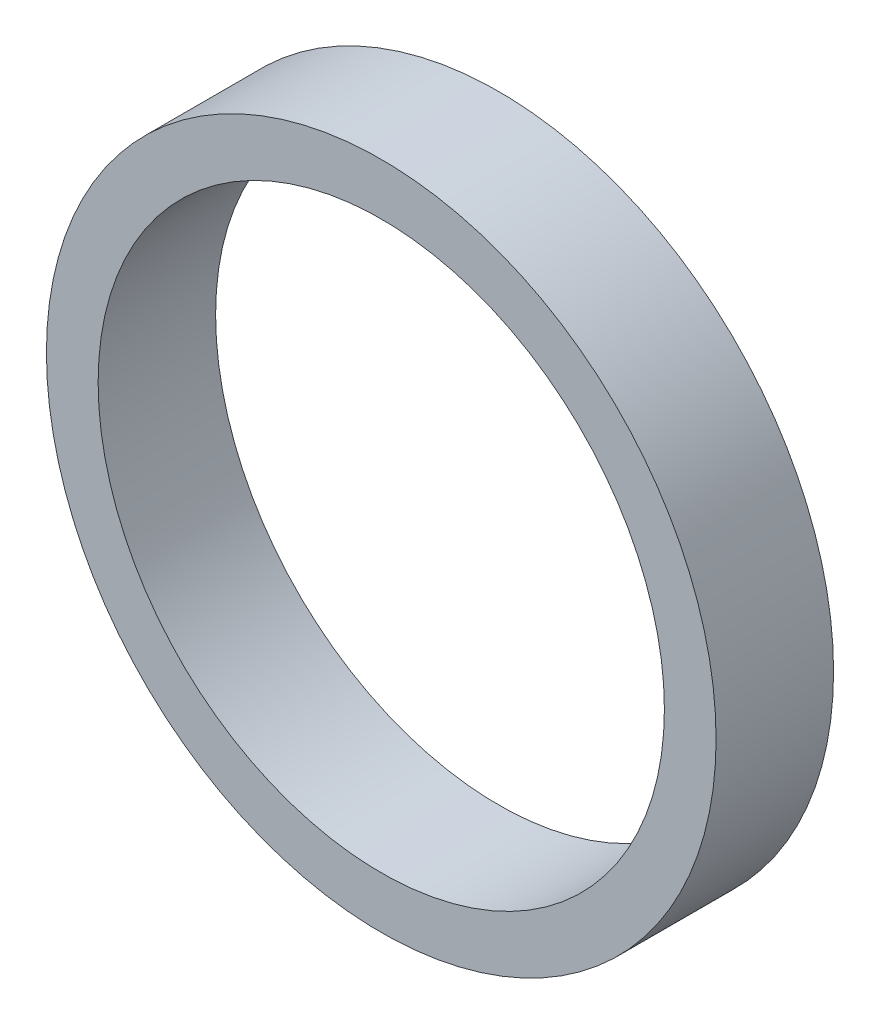
from build123d import *

# Parameters (mm, degrees)
SKETCH_1_R      = 14.25
SKETCH_1_R_2    = 12.05
EXTRUDE_1_DEPTH = 5


with BuildPart() as part:
    # 스케치1 → 보스-돌출1 (new body)
    with BuildSketch(Plane.XY):
        Circle(SKETCH_1_R)
        Circle(SKETCH_1_R_2, mode=Mode.SUBTRACT)
    extrude(amount=EXTRUDE_1_DEPTH)


solid = part.part
